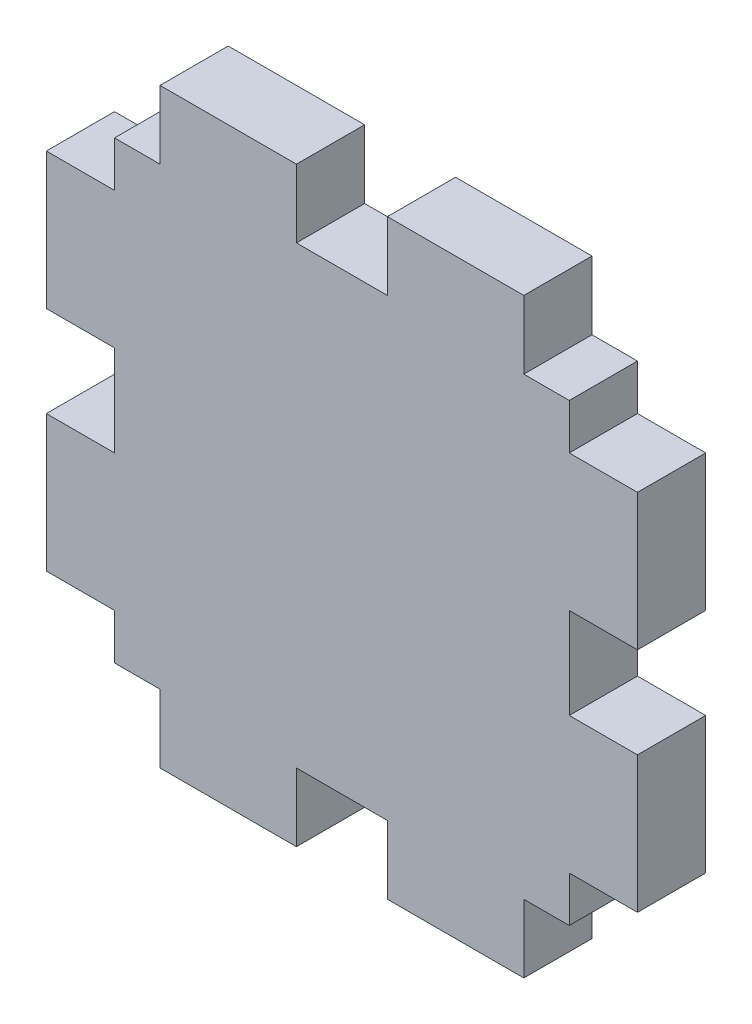
from build123d import *

# Parameters (mm, degrees)
EXTRUDE_1_DEPTH = 3


with BuildPart() as part:
    # 草图1 → 凸台-拉伸1 (new body)
    with BuildSketch(Plane.XY):
        Polygon((-10, 10), (-8, 10), (-8, 13), (-2, 13), (-2, 10), (2, 10), (2, 13), (8, 13), (8, 10), (10, 10), (10, 8), (13, 8), (13, 2), (10, 2), (10, -2), (13, -2), (13, -8), (10, -8), (10, -10), (8, -10), (8, -13), (2, -13), (2, -10), (-2, -10), (-2, -13), (-8, -13), (-8, -10), (-10, -10), (-10, -8), (-13, -8), (-13, -2), (-10, -2), (-10, 2), (-13, 2), (-13, 8), (-10, 8), align=None)
    extrude(amount=EXTRUDE_1_DEPTH)


solid = part.part
